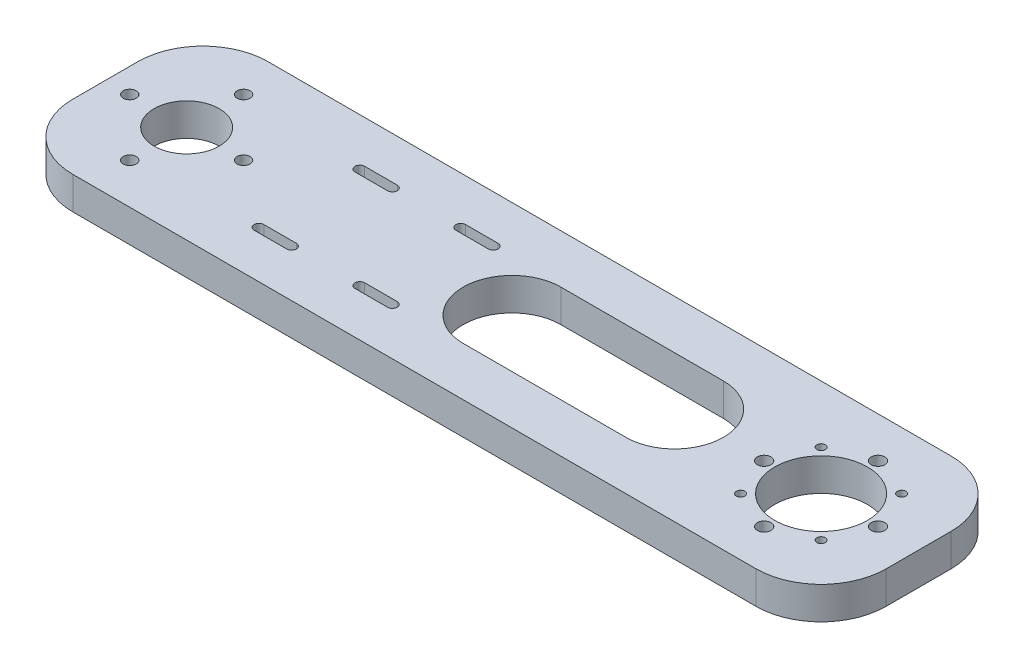
from build123d import *

# Parameters (mm, degrees)
SKETCH_1_W               = 250
SKETCH_1_H               = 60
EXTRUDE_1_DEPTH          = 10
FILLET_1_R               = 20
SKETCH_5_R               = 10
CUT_EXTRUDE_3_DEPTH      = 10
SKETCH_15_R              = 14.25
CUT_EXTRUDE_12_DEPTH     = 129.937969582
SKETCH_18_R              = 1.3
CUT_EXTRUDE_14_DEPTH     = 129.937969582
CUT_EXTRUDE_15_DEPTH     = 129.937969582
SKETCH_20_R              = 2
CUT_EXTRUDE_16_DEPTH     = 10
SKETCH_21_R              = 2.1
CUT_EXTRUDE_17_DEPTH     = 10
CUT_EXTRUDE_18_DEPTH     = 129.937969582
PATTERN_CIRCULAR_1_COUNT = 4


with BuildPart() as part:
    # 草图1 → 凸台-拉伸1 (new body)
    with BuildSketch(Plane(origin=(0, 0, 0), x_dir=(1, 0, 0), z_dir=(0, 1, 0))):
        Rectangle(SKETCH_1_W, SKETCH_1_H)
    extrude(amount=EXTRUDE_1_DEPTH)

    # 圆角1
    fillet_1_edges = [part.edges().sort_by_distance(p)[0] for p in [
        (125, 5, 30),
        (-125, 5, 30),
        (-125, 5, -30),
        (125, 5, -30),
    ]]
    fillet(fillet_1_edges, radius=FILLET_1_R)

    # 草图5 → 切除-拉伸3 (cut)
    with BuildSketch(Plane.XZ):
        with Locations(Location((-100, 0, 0), (0, 0, 270))):
            Circle(SKETCH_5_R)
    extrude(amount=-CUT_EXTRUDE_3_DEPTH, mode=Mode.SUBTRACT)

    # 草图15 → 切除-拉伸12 (cut, through all)
    with BuildSketch(Plane.XZ):
        with Locations(Location((95, 0, 0), (0, 0, 270))):
            Circle(SKETCH_15_R)
    extrude(amount=-CUT_EXTRUDE_12_DEPTH, mode=Mode.SUBTRACT)

    # 草图18 → 切除-拉伸14 (cut, through all)
    with BuildSketch(Plane.XZ):
        with Locations(Location((82.625631329, 12.374368671, 0), (0, 0, 270))):
            Circle(SKETCH_18_R)
        with Locations(Location((107.374368671, 12.374368671, 0), (0, 0, 270))):
            Circle(SKETCH_18_R)
        with Locations(Location((107.374368671, -12.374368671, 0), (0, 0, 270))):
            Circle(SKETCH_18_R)
        with Locations(Location((82.625631329, -12.374368671, 0), (0, 0, 270))):
            Circle(SKETCH_18_R)
    extrude(amount=-CUT_EXTRUDE_14_DEPTH, mode=Mode.SUBTRACT)

    # 草图19 → 切除-拉伸15 (cut, through all)
    with BuildSketch(Plane(origin=(0, 0, 0), x_dir=(-1, 0, 0), z_dir=(0, -1, 0))):
        with BuildLine():
            Line((62.26537952, 17), (52.26537952, 17))
            ThreePointArc((52.26537952, 17), (50.76537952, 15.5), (52.26537952, 14))
            Line((52.26537952, 14), (62.26537952, 14))
            ThreePointArc((62.26537952, 14), (63.76537952, 15.5), (62.26537952, 17))
        make_face()
        with BuildLine():
            Line((31.26537952, -17), (21.26537952, -17))
            ThreePointArc((21.26537952, -17), (19.76537952, -15.5), (21.26537952, -14))
            Line((21.26537952, -14), (31.26537952, -14))
            ThreePointArc((31.26537952, -14), (32.76537952, -15.5), (31.26537952, -17))
        make_face()
        with BuildLine():
            Line((31.26537952, 17), (21.26537952, 17))
            ThreePointArc((21.26537952, 17), (19.76537952, 15.5), (21.26537952, 14))
            Line((21.26537952, 14), (31.26537952, 14))
            ThreePointArc((31.26537952, 14), (32.76537952, 15.5), (31.26537952, 17))
        make_face()
        with BuildLine():
            Line((62.26537952, -17), (52.26537952, -17))
            ThreePointArc((52.26537952, -17), (50.76537952, -15.5), (52.26537952, -14))
            Line((52.26537952, -14), (62.26537952, -14))
            ThreePointArc((62.26537952, -14), (63.76537952, -15.5), (62.26537952, -17))
        make_face()
    extrude(amount=-CUT_EXTRUDE_15_DEPTH, mode=Mode.SUBTRACT)

    # 草图20 → 切除-拉伸16 (cut)
    with BuildSketch(Plane(origin=(0, 10, 0), x_dir=(1, 0, 0), z_dir=(0, 1, 0))):
        with Locations(Location((-100, 17.5, 0), (0, 0, 270))):
            Circle(SKETCH_20_R)
    cut_extrude_16 = extrude(amount=-CUT_EXTRUDE_16_DEPTH, mode=Mode.SUBTRACT)

    # 草图21 → 切除-拉伸17 (cut)
    with BuildSketch(Plane.XZ):
        with Locations(Location((95, 17.5, 0), (0, 0, 270))):
            Circle(SKETCH_21_R)
        with Locations(Location((112.5, 0, 0), (0, 0, 270))):
            Circle(SKETCH_21_R)
        with Locations(Location((95, -17.5, 0), (0, 0, 270))):
            Circle(SKETCH_21_R)
        with Locations(Location((77.5, 0, 0), (0, 0, 270))):
            Circle(SKETCH_21_R)
    extrude(amount=-CUT_EXTRUDE_17_DEPTH, mode=Mode.SUBTRACT)

    # 草图22 → 切除-拉伸18 (cut, through all)
    with BuildSketch(Plane(origin=(0, 10, 0), x_dir=(1, 0, 0), z_dir=(0, 1, 0))):
        with BuildLine():
            Line((0, 15), (50, 15))
            ThreePointArc((50, 15), (65, 0), (50, -15))
            Line((50, -15), (0, -15))
            ThreePointArc((0, -15), (-15, 0), (0, 15))
        make_face()
    extrude(amount=-CUT_EXTRUDE_18_DEPTH, mode=Mode.SUBTRACT)

    # 阵列(圆周)1: 切除-拉伸16 ×4 about axis
    pattern_circular_1_axis = Axis((-100, 0, 0), (0, 1, 0))
    for i in range(1, PATTERN_CIRCULAR_1_COUNT):
        add(cut_extrude_16.rotate(pattern_circular_1_axis, i * 360 / PATTERN_CIRCULAR_1_COUNT), mode=Mode.SUBTRACT)


solid = part.part
